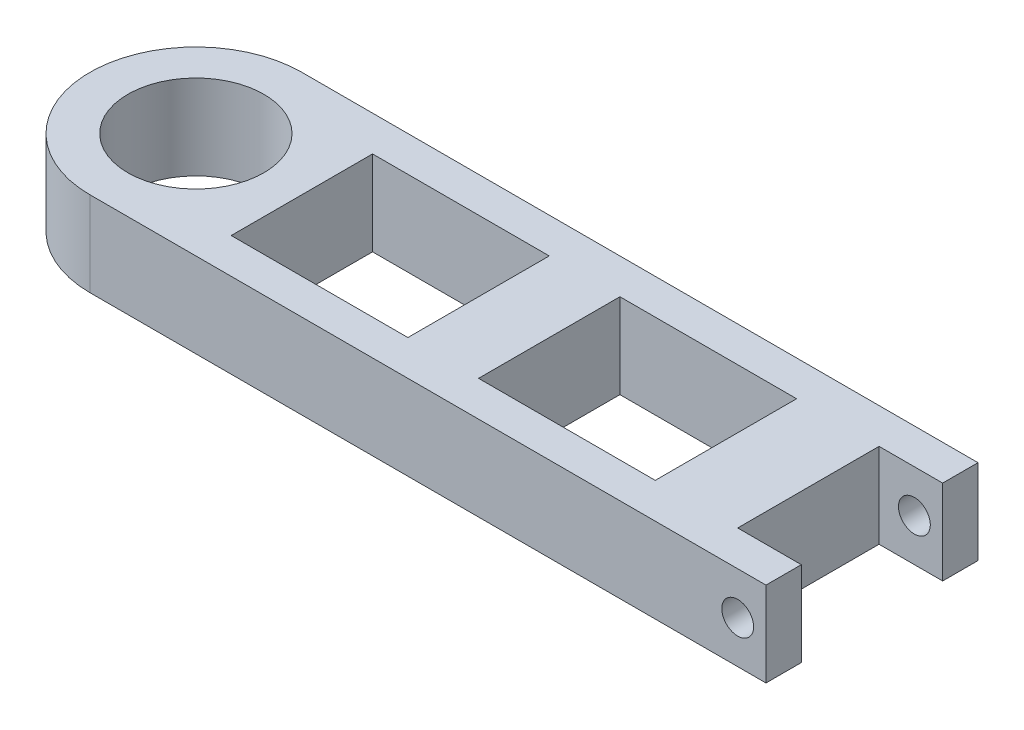
from build123d import *

# Parameters (mm, degrees)
SKETCH1_R           = 9.625
SKETCH1_W           = 25
SKETCH1_H           = 20
BOSS_EXTRUDE1_DEPTH = 12
SKETCH2_R           = 2.25
CUT_EXTRUDE1_DEPTH  = 154.440542231


with BuildPart() as part:
    # Sketch1 → Boss-Extrude1 (new body)
    with BuildSketch(Plane(origin=(0, 0, 0), x_dir=(1, 0, 0), z_dir=(0, 1, 0))):
        with BuildLine():
            Line((-135, 15), (-39.3333, 15))
            Line((-39.3333, 15), (-39.3333, 10))
            Line((-39.3333, 10), (-48.3333, 10))
            Line((-48.3333, 10), (-48.3333, -10))
            Line((-48.3333, -10), (-39.3333, -10))
            Line((-39.3333, -10), (-39.3333, -15))
            Line((-39.3333, -15), (-135, -15))
            ThreePointArc((-135, -15), (-150, 0), (-135, 15))
        make_face()
        with Locations(Location((-135, 0, 0), (0, 0, 270))):
            Circle(SKETCH1_R, mode=Mode.SUBTRACT)
        with Locations((-107.5, 0)):
            Rectangle(SKETCH1_W, SKETCH1_H, mode=Mode.SUBTRACT)
        with Locations((-72.5, 0)):
            Rectangle(SKETCH1_W, SKETCH1_H, mode=Mode.SUBTRACT)
    extrude(amount=BOSS_EXTRUDE1_DEPTH)

    # Sketch2 → Cut-Extrude1 (cut, through all)
    with BuildSketch(Plane(origin=(0, 0, -15), x_dir=(-1, 0, 0), z_dir=(0, 0, -1))):
        with Locations((43.3333, 6)):
            Circle(SKETCH2_R)
    extrude(amount=-CUT_EXTRUDE1_DEPTH, mode=Mode.SUBTRACT)


solid = part.part
